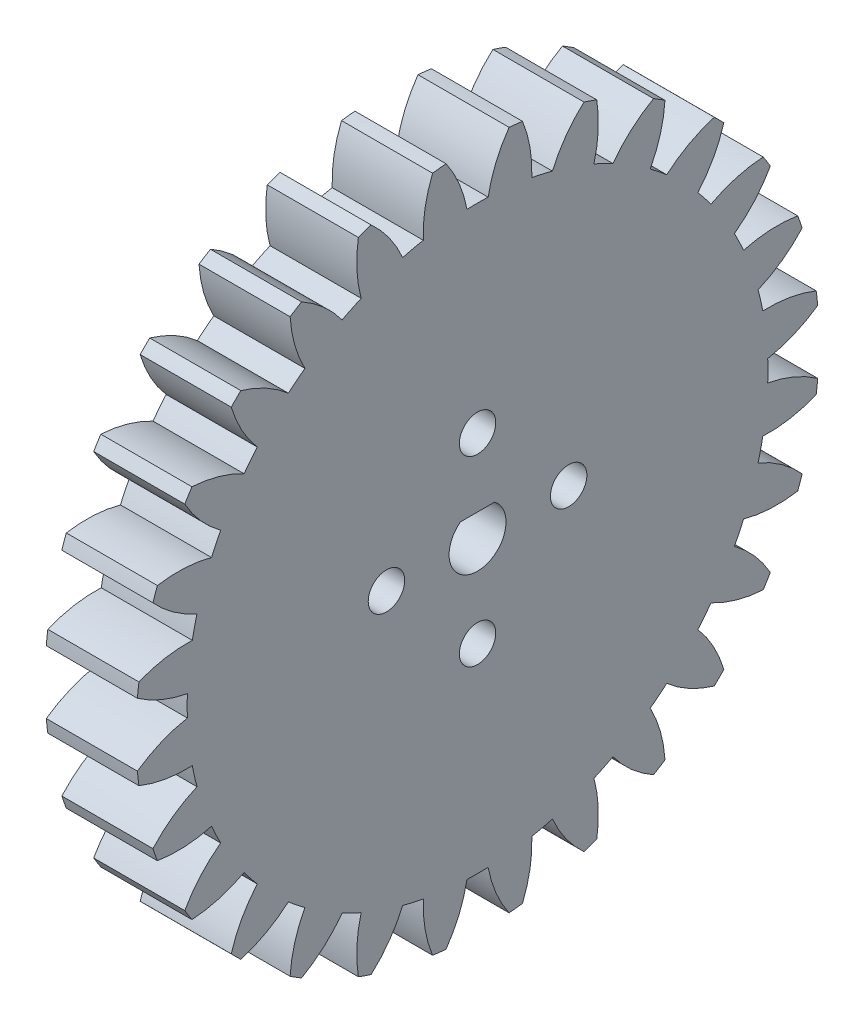
from build123d import *

# Parameters (mm, degrees)
BASPROSKE_W              = 8
BASPROSKE_H              = 30
TOOTHCUT_DEPTH           = 44.17406629
TEETHCUTS_COUNT          = 28
TEETHCUTS_ANGLE          = 347.142857143
BORSKE_R                 = 0.1
BORE_DEPTH               = 50.0000508
TAGLIO_ESTRUSIONE1_DEPTH = 30
SCHIZZO2_R               = 1.6
TAGLIO_ESTRUSIONE2_DEPTH = 10


with BuildPart() as part:
    # BasProSke → Base-Revolve (revolve)
    with BuildSketch(Plane(origin=(0, 0, 0), x_dir=(1, 0, 0), z_dir=(0, 1, 0)), mode=Mode.PRIVATE) as base_revolve_sk:
        with Locations((4, 15)):
            Rectangle(BASPROSKE_W, BASPROSKE_H)
    revolve(base_revolve_sk.sketch.rotate(Axis((-10, 0, 0), (1, 0, 0)), 180), axis=Axis((-10, 0, 0), (1, 0, 0)))

    # TooCutSke → ToothCut (cut, through all)
    with BuildSketch(Plane(origin=(0, 0, 0), x_dir=(0, 0, -1), z_dir=(1, 0, 0))):
        with BuildLine():
            ThreePointArc((0.928503763, 25.482089431), (0, 25.499), (-0.928503763, 25.482089431))
            ThreePointArc((-0.928503763, 25.482089431), (-1.618524429, 27.789411612), (-2.78585155, 29.895880591))
            ThreePointArc((-2.78585155, 29.895880591), (0, 30.0254), (2.78585155, 29.895880591))
            ThreePointArc((2.78585155, 29.895880591), (1.618524429, 27.789411612), (0.928503763, 25.482089431))
        make_face()
    toothcut = extrude(amount=TOOTHCUT_DEPTH, mode=Mode.SUBTRACT)

    # TeethCuts: ToothCut ×28 about axis
    teethcuts_axis = Axis((-10, 0, 0), (1, 0, 0))
    for i in range(1, TEETHCUTS_COUNT):
        add(toothcut.rotate(teethcuts_axis, i * TEETHCUTS_ANGLE / (TEETHCUTS_COUNT - 1)), mode=Mode.SUBTRACT)

    # BorSke → Bore (cut, symmetric)
    with BuildSketch(Plane(origin=(0, 0, 0), x_dir=(0, 0, -1), z_dir=(1, 0, 0))):
        with Locations(Location((0, 0, 0), (0, 0, 180))):
            Circle(BORSKE_R)
    extrude(amount=BORE_DEPTH, both=True, mode=Mode.SUBTRACT)

    # Schizzo1 → Taglio-Estrusione1 (cut)
    with BuildSketch(Plane(origin=(8, 0, 0), x_dir=(0, 0, -1), z_dir=(1, 0, 0))):
        with BuildLine():
            Line((-1.5, 2), (1.5, 2))
            ThreePointArc((1.5, 2), (0, -2.5), (-1.5, 2))
        make_face()
    extrude(amount=-TAGLIO_ESTRUSIONE1_DEPTH, mode=Mode.SUBTRACT)

    # Schizzo2 → Taglio-Estrusione2 (cut)
    with BuildSketch(Plane.ZY):
        with Locations((0, 8)):
            Circle(SCHIZZO2_R)
        with Locations((8, 0)):
            Circle(SCHIZZO2_R)
        with Locations((0, -8)):
            Circle(SCHIZZO2_R)
        with Locations((-8, 0)):
            Circle(SCHIZZO2_R)
    extrude(amount=-TAGLIO_ESTRUSIONE2_DEPTH, mode=Mode.SUBTRACT)


solid = part.part
